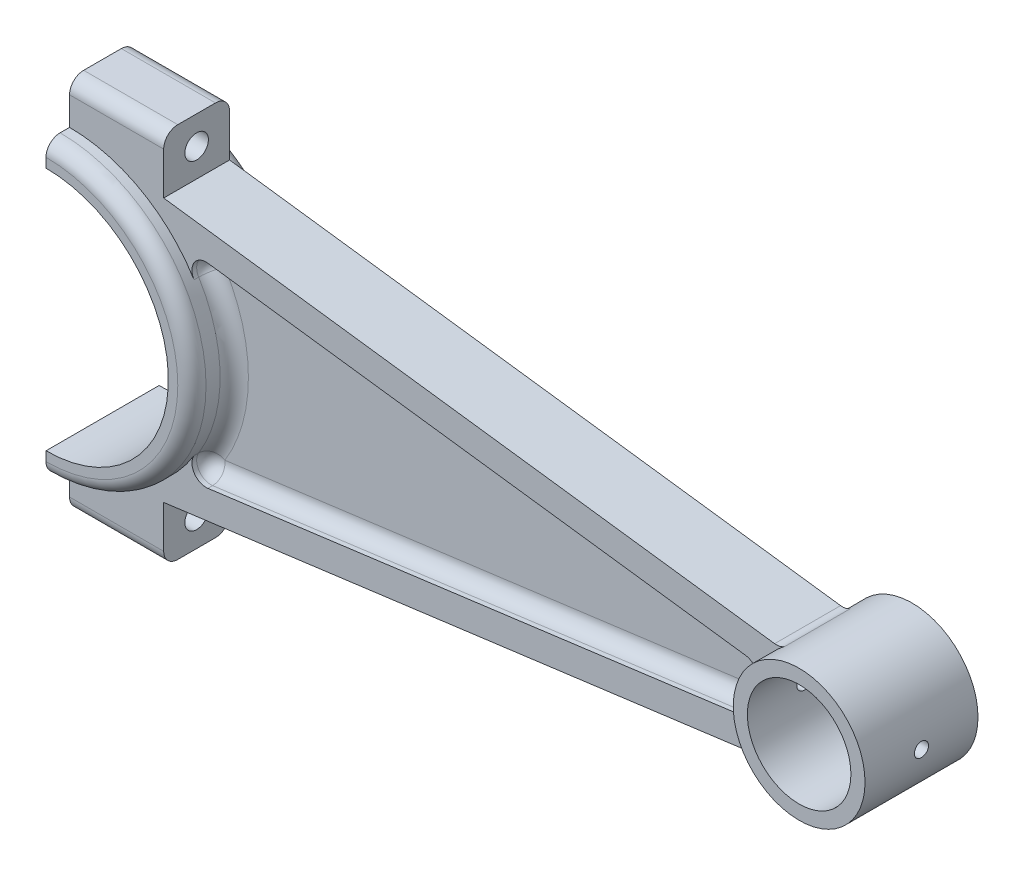
from build123d import *

# Parameters (mm, degrees)
EXTRUDE_1_DEPTH     = 12
SKETCH_3_R          = 11
CUT_EXTRUDE_1_DEPTH = 179.941331168
CUT_EXTRUDE_START   = -5
CUT_EXTRUDE_2_DEPTH = 5
CUT_EXTRUDE_START_2 = -4
CUT_EXTRUDE_3_DEPTH = 4
SKETCH_6_R          = 2.5
CUT_EXTRUDE_4_DEPTH = 160.561900214
FILLET_1_R          = 3
FILLET_2_R          = 3
SKETCH_7_R          = 1.5
CUT_EXTRUDE_6_DEPTH = 179.941331168


with BuildPart() as part:
    # 草图1 → 拉伸1 (new body)
    with BuildSketch(Plane.XY):
        with BuildLine():
            Line((0, -40), (0, -26))
            ThreePointArc((0, -26), (26, 0), (0, 26))
            Line((0, 26), (0, 40))
            Line((0, 40), (20, 40))
            Line((20, 40), (20, 28))
            Line((20, 28), (149.800932204, 10.911383086))
            ThreePointArc((149.800932204, 10.911383086), (150.911506836, 10.973150989), (151.923244173, 11.435296905))
            ThreePointArc((151.923244173, 11.435296905), (174, 0), (151.923244173, -11.435296905))
            ThreePointArc((151.923244173, -11.435296905), (150.911506836, -10.973150989), (149.800932204, -10.911383086))
            Line((149.800932204, -10.911383086), (20, -28))
            Line((20, -28), (20, -40))
            Line((20, -40), (0, -40))
        make_face()
    extrude(amount=EXTRUDE_1_DEPTH)

    # 草图3 → 切除-拉伸1 (cut, through all)
    with BuildSketch(Plane.XY.offset(12)):
        with Locations((160, 0)):
            Circle(SKETCH_3_R)
    extrude(amount=-CUT_EXTRUDE_1_DEPTH, mode=Mode.SUBTRACT)

    # 草图4 → 切除-拉伸2 (cut)
    with BuildSketch(Plane.XY.offset(12).offset(CUT_EXTRUDE_START)):
        with BuildLine():
            Line((0, 40), (0, 31))
            ThreePointArc((0, 31), (31, 0), (0, -31))
            Line((0, -31), (0, -40))
            Line((0, -40), (20, -40))
            Line((20, -40), (20, -28))
            Line((20, -28), (149.800932204, -10.911383086))
            ThreePointArc((149.800932204, -10.911383086), (150.911506836, -10.973150989), (151.923244173, -11.435296905))
            ThreePointArc((151.923244173, -11.435296905), (146, 0), (151.923244173, 11.435296905))
            ThreePointArc((151.923244173, 11.435296905), (150.911506836, 10.973150989), (149.800932204, 10.911383086))
            Line((149.800932204, 10.911383086), (20, 28))
            Line((20, 28), (20, 40))
            Line((20, 40), (0, 40))
        make_face()
    extrude(amount=CUT_EXTRUDE_2_DEPTH, mode=Mode.SUBTRACT)

    # 草图5 → 切除-拉伸3 (cut)
    with BuildSketch(Plane.XY.offset(7).offset(CUT_EXTRUDE_START_2)):
        with BuildLine():
            Line((143.607465988, 5.674994619), (29.398745634, 20.7108579))
            ThreePointArc((29.398745634, 20.7108579), (26.491956539, 19.371673477), (26.44771114, 16.171535964))
            ThreePointArc((26.44771114, 16.171535964), (31, 0), (26.44771114, -16.171535964))
            ThreePointArc((26.44771114, -16.171535964), (26.491956539, -19.371673477), (29.398745634, -20.7108579))
            Line((29.398745634, -20.7108579), (143.607465988, -5.674994619))
            ThreePointArc((143.607465988, -5.674994619), (145.621853626, -4.492677495), (146.177789633, -2.22407297))
            ThreePointArc((146.177789633, -2.22407297), (146, 0), (146.177789633, 2.22407297))
            ThreePointArc((146.177789633, 2.22407297), (145.621853626, 4.492677495), (143.607465988, 5.674994619))
        make_face()
    extrude(amount=CUT_EXTRUDE_3_DEPTH, mode=Mode.SUBTRACT)

    # 镜向1: part across plane


with BuildPart() as part_1:
    add(part.part)
    add(part.part.mirror(Plane.XY))

    # 草图6 → 切除-拉伸4 (cut, through all)
    with BuildSketch(Plane(origin=(20, 0, 0), x_dir=(0, 0, -1), z_dir=(1, 0, 0))):
        with Locations((0, -34)):
            Circle(SKETCH_6_R)
    cut_extrude_4 = extrude(amount=-CUT_EXTRUDE_4_DEPTH, mode=Mode.SUBTRACT)

    # 镜向2: 切除-拉伸4 across plane
    add(cut_extrude_4.mirror(Plane.ZX), mode=Mode.SUBTRACT)

    # 圆角1
    fillet_1_edges = [part_1.edges().sort_by_distance(p)[0] for p in [
        (10, 40, 7),
        (10, -40, 7),
        (31, 0, 12),
        (26.491956539, 19.371673477, 3),
        (86.503105811, 13.192926259, 3),
        (145.621853626, 4.492677495, 3),
        (146, 0, 3),
        (145.621853626, -4.492677495, 3),
        (86.503105811, -13.192926259, 3),
        (26.491956539, -19.371673477, 3),
        (31, 0, 3),
    ]]
    fillet(fillet_1_edges, radius=FILLET_1_R)

    # 圆角2
    fillet_2_edges = [part_1.edges().sort_by_distance(p)[0] for p in [
        (10, 40, -7),
        (10, -40, -7),
        (146, 0, -3),
        (31, 0, -12),
        (31, 0, -3),
        (26.491956539, 19.371673477, -3),
        (86.503105811, 13.192926259, -3),
        (145.621853626, 4.492677495, -3),
        (145.621853626, -4.492677495, -3),
        (86.503105811, -13.192926259, -3),
        (26.491956539, -19.371673477, -3),
    ]]
    fillet(fillet_2_edges, radius=FILLET_2_R)

    # 草图7 → 切除-拉伸6 (cut, through all)
    with BuildSketch(Plane(origin=(0, 0, 0), x_dir=(0, 0, -1), z_dir=(1, 0, 0))):
        with Locations(Location((0, 0, 0), (0, 0, 180))):
            Circle(SKETCH_7_R)
    extrude(amount=CUT_EXTRUDE_6_DEPTH, mode=Mode.SUBTRACT)


solid = part_1.part
